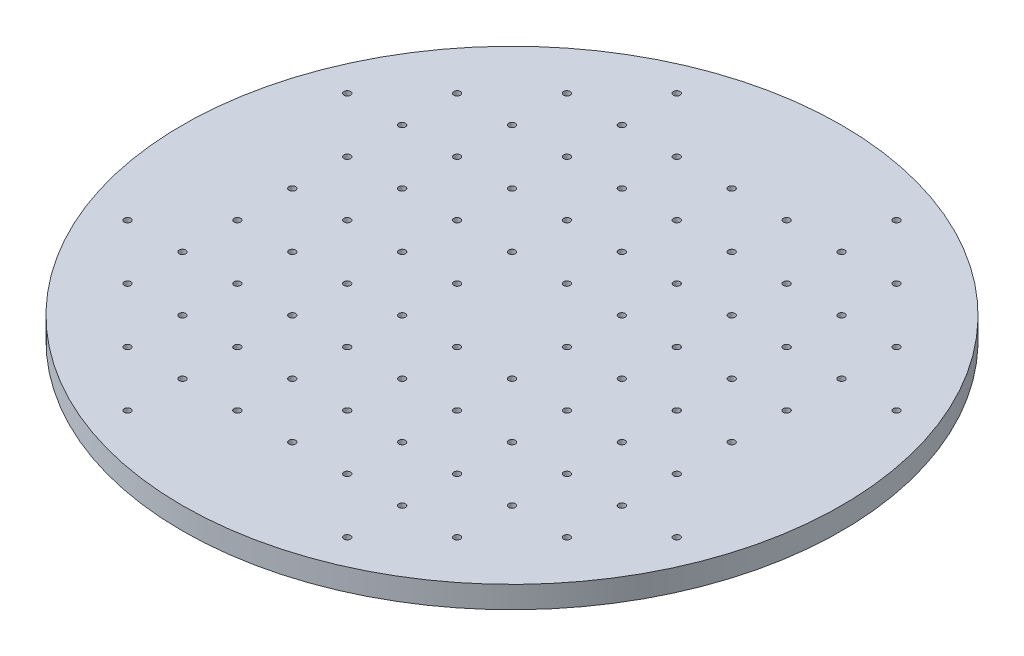
from build123d import *

# Parameters (mm, degrees)
SKETCH_2_R      = 300
SKETCH_2_R_2    = 3
EXTRUDE_1_DEPTH = 20


with BuildPart() as part:
    # Эскиз2 → Бобышка-Вытянуть1 (new body)
    with BuildSketch(Plane(origin=(0, 0, 0), x_dir=(1, 0, 0), z_dir=(0, 1, 0))):
        with Locations(Location((0, 0, 0), (0, 0, 270))):
            Circle(SKETCH_2_R)
        with Locations(Location((-50, 50, 0), (0, 0, 270))):
            Circle(SKETCH_2_R_2, mode=Mode.SUBTRACT)
        with Locations(Location((-100, 50, 0), (0, 0, 270))):
            Circle(SKETCH_2_R_2, mode=Mode.SUBTRACT)
        with Locations(Location((-150, 50, 0), (0, 0, 270))):
            Circle(SKETCH_2_R_2, mode=Mode.SUBTRACT)
        with Locations(Location((-200, 50, 0), (0, 0, 270))):
            Circle(SKETCH_2_R_2, mode=Mode.SUBTRACT)
        with Locations(Location((-50, 100, 0), (0, 0, 270))):
            Circle(SKETCH_2_R_2, mode=Mode.SUBTRACT)
        with Locations(Location((-100, 100, 0), (0, 0, 270))):
            Circle(SKETCH_2_R_2, mode=Mode.SUBTRACT)
        with Locations(Location((-150, 100, 0), (0, 0, 270))):
            Circle(SKETCH_2_R_2, mode=Mode.SUBTRACT)
        with Locations(Location((-200, 100, 0), (0, 0, 270))):
            Circle(SKETCH_2_R_2, mode=Mode.SUBTRACT)
        with Locations(Location((-250, 100, 0), (0, 0, 270))):
            Circle(SKETCH_2_R_2, mode=Mode.SUBTRACT)
        with Locations(Location((-50, 150, 0), (0, 0, 270))):
            Circle(SKETCH_2_R_2, mode=Mode.SUBTRACT)
        with Locations(Location((-100, 150, 0), (0, 0, 270))):
            Circle(SKETCH_2_R_2, mode=Mode.SUBTRACT)
        with Locations(Location((-150, 150, 0), (0, 0, 270))):
            Circle(SKETCH_2_R_2, mode=Mode.SUBTRACT)
        with Locations(Location((-200, 150, 0), (0, 0, 270))):
            Circle(SKETCH_2_R_2, mode=Mode.SUBTRACT)
        with Locations(Location((-50, 200, 0), (0, 0, 270))):
            Circle(SKETCH_2_R_2, mode=Mode.SUBTRACT)
        with Locations(Location((-100, 200, 0), (0, 0, 270))):
            Circle(SKETCH_2_R_2, mode=Mode.SUBTRACT)
        with Locations(Location((-150, 200, 0), (0, 0, 270))):
            Circle(SKETCH_2_R_2, mode=Mode.SUBTRACT)
        with Locations(Location((-100, 250, 0), (0, 0, 270))):
            Circle(SKETCH_2_R_2, mode=Mode.SUBTRACT)
        with Locations(Location((-50, 0, 0), (0, 0, 270))):
            Circle(SKETCH_2_R_2, mode=Mode.SUBTRACT)
        with Locations(Location((-150, 0, 0), (0, 0, 270))):
            Circle(SKETCH_2_R_2, mode=Mode.SUBTRACT)
        with Locations(Location((-100, 0, 0), (0, 0, 270))):
            Circle(SKETCH_2_R_2, mode=Mode.SUBTRACT)
        with Locations(Location((-200, 0, 0), (0, 0, 270))):
            Circle(SKETCH_2_R_2, mode=Mode.SUBTRACT)
        with Locations(Location((0, 50, 0), (0, 0, 270))):
            Circle(SKETCH_2_R_2, mode=Mode.SUBTRACT)
        with Locations(Location((0, 100, 0), (0, 0, 270))):
            Circle(SKETCH_2_R_2, mode=Mode.SUBTRACT)
        with Locations(Location((0, 150, 0), (0, 0, 270))):
            Circle(SKETCH_2_R_2, mode=Mode.SUBTRACT)
        with Locations(Location((0, 200, 0), (0, 0, 270))):
            Circle(SKETCH_2_R_2, mode=Mode.SUBTRACT)
        with Locations(Location((200, 0, 0), (0, 0, 90))):
            Circle(SKETCH_2_R_2, mode=Mode.SUBTRACT)
        with Locations(Location((100, 0, 0), (0, 0, 90))):
            Circle(SKETCH_2_R_2, mode=Mode.SUBTRACT)
        with Locations(Location((150, 0, 0), (0, 0, 90))):
            Circle(SKETCH_2_R_2, mode=Mode.SUBTRACT)
        with Locations(Location((50, 0, 0), (0, 0, 90))):
            Circle(SKETCH_2_R_2, mode=Mode.SUBTRACT)
        with Locations(Location((100, 250, 0), (0, 0, 90))):
            Circle(SKETCH_2_R_2, mode=Mode.SUBTRACT)
        with Locations(Location((150, 200, 0), (0, 0, 90))):
            Circle(SKETCH_2_R_2, mode=Mode.SUBTRACT)
        with Locations(Location((100, 200, 0), (0, 0, 90))):
            Circle(SKETCH_2_R_2, mode=Mode.SUBTRACT)
        with Locations(Location((50, 200, 0), (0, 0, 90))):
            Circle(SKETCH_2_R_2, mode=Mode.SUBTRACT)
        with Locations(Location((200, 150, 0), (0, 0, 90))):
            Circle(SKETCH_2_R_2, mode=Mode.SUBTRACT)
        with Locations(Location((150, 150, 0), (0, 0, 90))):
            Circle(SKETCH_2_R_2, mode=Mode.SUBTRACT)
        with Locations(Location((100, 150, 0), (0, 0, 90))):
            Circle(SKETCH_2_R_2, mode=Mode.SUBTRACT)
        with Locations(Location((50, 150, 0), (0, 0, 90))):
            Circle(SKETCH_2_R_2, mode=Mode.SUBTRACT)
        with Locations(Location((250, 100, 0), (0, 0, 90))):
            Circle(SKETCH_2_R_2, mode=Mode.SUBTRACT)
        with Locations(Location((200, 100, 0), (0, 0, 90))):
            Circle(SKETCH_2_R_2, mode=Mode.SUBTRACT)
        with Locations(Location((150, 100, 0), (0, 0, 90))):
            Circle(SKETCH_2_R_2, mode=Mode.SUBTRACT)
        with Locations(Location((100, 100, 0), (0, 0, 90))):
            Circle(SKETCH_2_R_2, mode=Mode.SUBTRACT)
        with Locations(Location((50, 100, 0), (0, 0, 90))):
            Circle(SKETCH_2_R_2, mode=Mode.SUBTRACT)
        with Locations(Location((200, 50, 0), (0, 0, 90))):
            Circle(SKETCH_2_R_2, mode=Mode.SUBTRACT)
        with Locations(Location((150, 50, 0), (0, 0, 90))):
            Circle(SKETCH_2_R_2, mode=Mode.SUBTRACT)
        with Locations(Location((100, 50, 0), (0, 0, 90))):
            Circle(SKETCH_2_R_2, mode=Mode.SUBTRACT)
        with Locations(Location((50, 50, 0), (0, 0, 90))):
            Circle(SKETCH_2_R_2, mode=Mode.SUBTRACT)
        with Locations(Location((50, -50, 0), (0, 0, 270))):
            Circle(SKETCH_2_R_2, mode=Mode.SUBTRACT)
        with Locations(Location((100, -50, 0), (0, 0, 270))):
            Circle(SKETCH_2_R_2, mode=Mode.SUBTRACT)
        with Locations(Location((150, -50, 0), (0, 0, 270))):
            Circle(SKETCH_2_R_2, mode=Mode.SUBTRACT)
        with Locations(Location((200, -50, 0), (0, 0, 270))):
            Circle(SKETCH_2_R_2, mode=Mode.SUBTRACT)
        with Locations(Location((50, -100, 0), (0, 0, 270))):
            Circle(SKETCH_2_R_2, mode=Mode.SUBTRACT)
        with Locations(Location((100, -100, 0), (0, 0, 270))):
            Circle(SKETCH_2_R_2, mode=Mode.SUBTRACT)
        with Locations(Location((150, -100, 0), (0, 0, 270))):
            Circle(SKETCH_2_R_2, mode=Mode.SUBTRACT)
        with Locations(Location((200, -100, 0), (0, 0, 270))):
            Circle(SKETCH_2_R_2, mode=Mode.SUBTRACT)
        with Locations(Location((250, -100, 0), (0, 0, 270))):
            Circle(SKETCH_2_R_2, mode=Mode.SUBTRACT)
        with Locations(Location((50, -150, 0), (0, 0, 270))):
            Circle(SKETCH_2_R_2, mode=Mode.SUBTRACT)
        with Locations(Location((100, -150, 0), (0, 0, 270))):
            Circle(SKETCH_2_R_2, mode=Mode.SUBTRACT)
        with Locations(Location((150, -150, 0), (0, 0, 270))):
            Circle(SKETCH_2_R_2, mode=Mode.SUBTRACT)
        with Locations(Location((200, -150, 0), (0, 0, 270))):
            Circle(SKETCH_2_R_2, mode=Mode.SUBTRACT)
        with Locations(Location((50, -200, 0), (0, 0, 270))):
            Circle(SKETCH_2_R_2, mode=Mode.SUBTRACT)
        with Locations(Location((100, -200, 0), (0, 0, 270))):
            Circle(SKETCH_2_R_2, mode=Mode.SUBTRACT)
        with Locations(Location((150, -200, 0), (0, 0, 270))):
            Circle(SKETCH_2_R_2, mode=Mode.SUBTRACT)
        with Locations(Location((100, -250, 0), (0, 0, 270))):
            Circle(SKETCH_2_R_2, mode=Mode.SUBTRACT)
        with Locations(Location((0, -200, 0), (0, 0, 90))):
            Circle(SKETCH_2_R_2, mode=Mode.SUBTRACT)
        with Locations(Location((0, -150, 0), (0, 0, 90))):
            Circle(SKETCH_2_R_2, mode=Mode.SUBTRACT)
        with Locations(Location((0, -100, 0), (0, 0, 90))):
            Circle(SKETCH_2_R_2, mode=Mode.SUBTRACT)
        with Locations(Location((0, -50, 0), (0, 0, 90))):
            Circle(SKETCH_2_R_2, mode=Mode.SUBTRACT)
        with Locations(Location((-100, -250, 0), (0, 0, 90))):
            Circle(SKETCH_2_R_2, mode=Mode.SUBTRACT)
        with Locations(Location((-150, -200, 0), (0, 0, 90))):
            Circle(SKETCH_2_R_2, mode=Mode.SUBTRACT)
        with Locations(Location((-100, -200, 0), (0, 0, 90))):
            Circle(SKETCH_2_R_2, mode=Mode.SUBTRACT)
        with Locations(Location((-50, -200, 0), (0, 0, 90))):
            Circle(SKETCH_2_R_2, mode=Mode.SUBTRACT)
        with Locations(Location((-200, -150, 0), (0, 0, 90))):
            Circle(SKETCH_2_R_2, mode=Mode.SUBTRACT)
        with Locations(Location((-150, -150, 0), (0, 0, 90))):
            Circle(SKETCH_2_R_2, mode=Mode.SUBTRACT)
        with Locations(Location((-100, -150, 0), (0, 0, 90))):
            Circle(SKETCH_2_R_2, mode=Mode.SUBTRACT)
        with Locations(Location((-50, -150, 0), (0, 0, 90))):
            Circle(SKETCH_2_R_2, mode=Mode.SUBTRACT)
        with Locations(Location((-250, -100, 0), (0, 0, 90))):
            Circle(SKETCH_2_R_2, mode=Mode.SUBTRACT)
        with Locations(Location((-200, -100, 0), (0, 0, 90))):
            Circle(SKETCH_2_R_2, mode=Mode.SUBTRACT)
        with Locations(Location((-150, -100, 0), (0, 0, 90))):
            Circle(SKETCH_2_R_2, mode=Mode.SUBTRACT)
        with Locations(Location((-100, -100, 0), (0, 0, 90))):
            Circle(SKETCH_2_R_2, mode=Mode.SUBTRACT)
        with Locations(Location((-50, -100, 0), (0, 0, 90))):
            Circle(SKETCH_2_R_2, mode=Mode.SUBTRACT)
        with Locations(Location((-200, -50, 0), (0, 0, 90))):
            Circle(SKETCH_2_R_2, mode=Mode.SUBTRACT)
        with Locations(Location((-150, -50, 0), (0, 0, 90))):
            Circle(SKETCH_2_R_2, mode=Mode.SUBTRACT)
        with Locations(Location((-100, -50, 0), (0, 0, 90))):
            Circle(SKETCH_2_R_2, mode=Mode.SUBTRACT)
        with Locations(Location((-50, -50, 0), (0, 0, 90))):
            Circle(SKETCH_2_R_2, mode=Mode.SUBTRACT)
    extrude(amount=EXTRUDE_1_DEPTH)


solid = part.part
